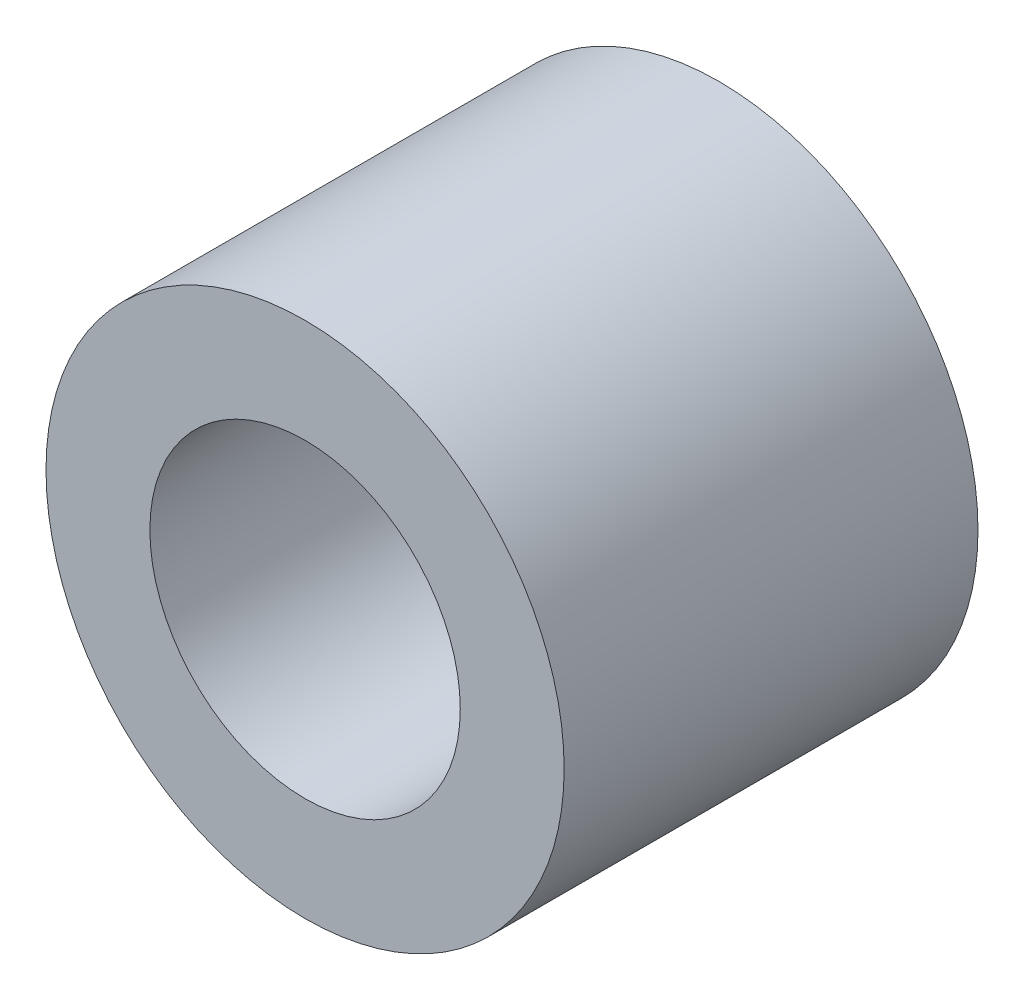
from build123d import *

# Parameters (mm, degrees)
BOSS_EXTRUDE1_DEPTH      = 6.35
BOSS_EXTRUDE1_DEPTH_BACK = 6.35
SKETCH5_R                = 7.9502
SKETCH5_R_2              = 4.7625


with BuildPart() as part:
    # Sketch5 → Boss-Extrude1 (new, two sides: drawn at the far end of the back side and taken through both)
    with BuildSketch(Plane.XY.offset(-BOSS_EXTRUDE1_DEPTH_BACK)):
        Circle(SKETCH5_R)
        Circle(SKETCH5_R_2, mode=Mode.SUBTRACT)
    extrude(amount=BOSS_EXTRUDE1_DEPTH + BOSS_EXTRUDE1_DEPTH_BACK)


solid = part.part
